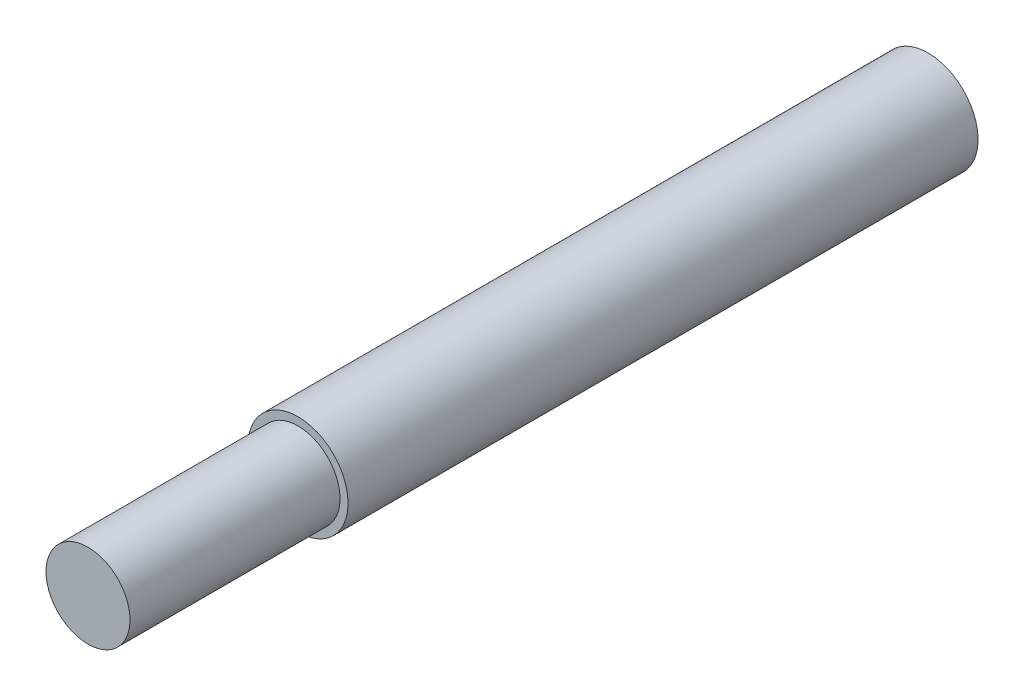
from build123d import *

# Parameters (mm, degrees)
ESBO_O1_R                = 4
RESSALTO_EXTRUS_O1_DEPTH = 20
ESBO_O2_R                = 4.7625
RESSALTO_EXTRUS_O2_DEPTH = 60


with BuildPart() as part:
    # Esboço1 → Ressalto-extrusão1 (new body)
    with BuildSketch(Plane.XY):
        Circle(ESBO_O1_R)
    extrude(amount=RESSALTO_EXTRUS_O1_DEPTH)

    # Esboço2 → Ressalto-extrusão2 (add)
    with BuildSketch(Plane(origin=(0, 0, 0), x_dir=(-1, 0, 0), z_dir=(0, 0, -1))):
        Circle(ESBO_O2_R)
    extrude(amount=RESSALTO_EXTRUS_O2_DEPTH)


solid = part.part
